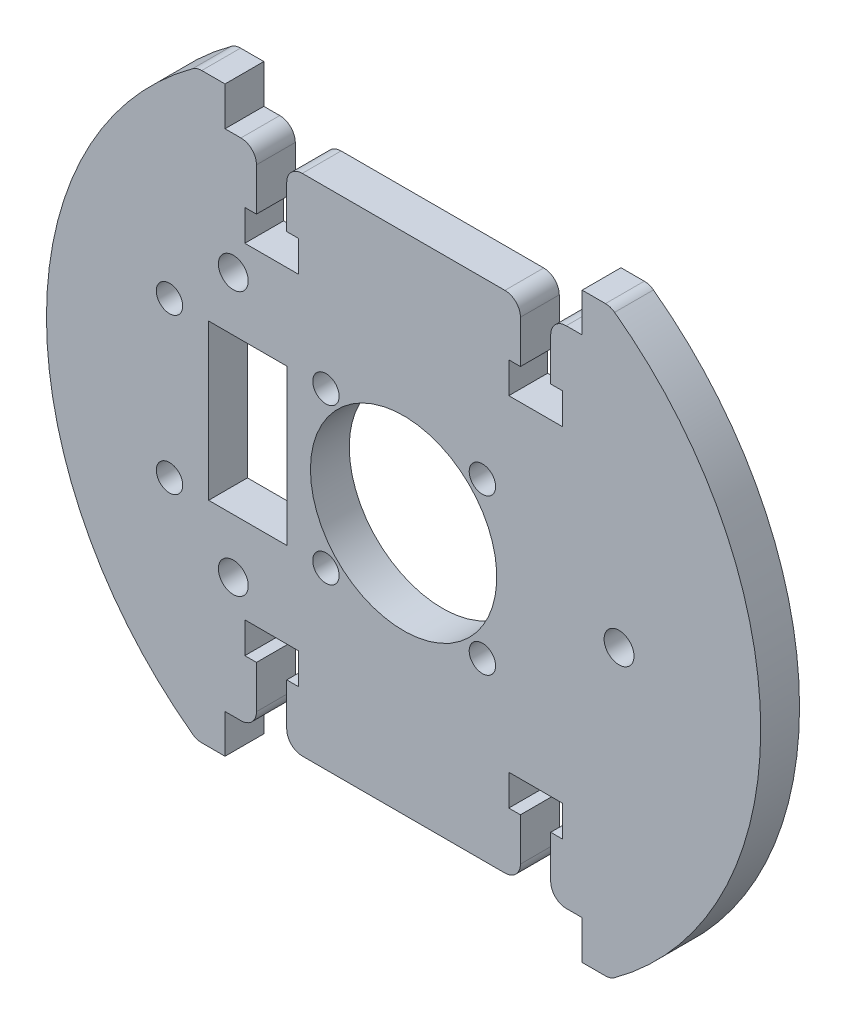
from build123d import *

# Parameters (mm, degrees)
ESQUISSE1_R         = 1.925
BOSS_EXTRU_1_DEPTH  = 5
SKETCH_1_W          = 8.010899758
SKETCH_1_H          = 5.2
SKETCH_1_W_2        = 7.665468451
EXTRUDE_1_DEPTH     = 5
SKETCH_2_W          = 8.485253828
SKETCH_2_H          = 20
EXTRUDE_2_DEPTH     = 5
SKETCH_3_R          = 1.6
CUT_EXTRUDE_1_DEPTH = 5
EXTRUDE_3_DEPTH     = 5
SKETCH_6_R          = 12
SKETCH_6_W          = 10.075
SKETCH_6_H          = 20
CUT_EXTRUDE_2_DEPTH = 5
SKETCH_7_R          = 1.7
SKETCH_7_R_2        = 11
CUT_EXTRUDE_3_DEPTH = 5


with BuildPart() as part:
    # Esquisse1 → Boss.-Extru.1 (new body)
    with BuildSketch(Plane.XY):
        with BuildLine():
            Line((13.05, 32.5), (-13.05, 32.5))
            ThreePointArc((-13.05, 32.5), (-14.464213562, 31.914213562), (-15.05, 30.5))
            Line((-15.05, 30.5), (-15.05, 25))
            Line((-15.05, 25), (-13.55, 25))
            Line((-13.55, 25), (-13.55, 21))
            Line((-13.55, 21), (-20.45, 21))
            Line((-20.45, 21), (-20.45, 25))
            Line((-20.45, 25), (-18.95, 25))
            Line((-18.95, 25), (-18.95, 30.5))
            ThreePointArc((-18.95, 30.5), (-19.535786438, 31.914213562), (-20.95, 32.5))
            Line((-20.95, 32.5), (-23, 32.5))
            Line((-23, 32.5), (-23, 37.5))
            Line((-23, 37.5), (-25.999999067, 37.497633905))
            ThreePointArc((-25.999999067, 37.497633905), (-26.620839292, 37.398317642), (-27.180168114, 37.111163374))
            ThreePointArc((-27.180168114, 37.111163374), (-45.999999844, 0), (-27.180168114, -37.111163374))
            ThreePointArc((-27.180168114, -37.111163374), (-26.620839292, -37.398317642), (-25.999999067, -37.497633905))
            Line((-25.999999067, -37.497633905), (-23, -37.5))
            Line((-23, -37.5), (-23, -32.5))
            Line((-23, -32.5), (-20.95, -32.5))
            ThreePointArc((-20.95, -32.5), (-19.535786438, -31.914213562), (-18.95, -30.5))
            Line((-18.95, -30.5), (-18.95, -25))
            Line((-18.95, -25), (-20.45, -25))
            Line((-20.45, -25), (-20.45, -21))
            Line((-20.45, -21), (-13.55, -21))
            Line((-13.55, -21), (-13.55, -25))
            Line((-13.55, -25), (-15.05, -25))
            Line((-15.05, -25), (-15.05, -30.5))
            ThreePointArc((-15.05, -30.5), (-14.464213562, -31.914213562), (-13.05, -32.5))
            Line((-13.05, -32.5), (13.05, -32.5))
            ThreePointArc((13.05, -32.5), (14.464213562, -31.914213562), (15.05, -30.5))
            Line((15.05, -30.5), (15.05, -25))
            Line((15.05, -25), (13.55, -25))
            Line((13.55, -25), (13.55, -21))
            Line((13.55, -21), (20.45, -21))
            Line((20.45, -21), (20.45, -25))
            Line((20.45, -25), (18.95, -25))
            Line((18.95, -25), (18.95, -30.5))
            ThreePointArc((18.95, -30.5), (19.535786438, -31.914213562), (20.95, -32.5))
            Line((20.95, -32.5), (23, -32.5))
            Line((23, -32.5), (23, -37.5))
            Line((23, -37.5), (25.999999067, -37.497633905))
            ThreePointArc((25.999999067, -37.497633905), (26.620839292, -37.398317642), (27.180168114, -37.111163374))
            ThreePointArc((27.180168114, -37.111163374), (45.999999844, 0), (27.180168114, 37.111163374))
            ThreePointArc((27.180168114, 37.111163374), (26.620839292, 37.398317642), (25.999999067, 37.497633905))
            Line((25.999999067, 37.497633905), (23, 37.5))
            Line((23, 37.5), (23, 32.5))
            Line((23, 32.5), (20.95, 32.5))
            ThreePointArc((20.95, 32.5), (19.535786438, 31.914213562), (18.95, 30.5))
            Line((18.95, 30.5), (18.95, 25))
            Line((18.95, 25), (20.45, 25))
            Line((20.45, 25), (20.45, 21))
            Line((20.45, 21), (13.55, 21))
            Line((13.55, 21), (13.55, 25))
            Line((13.55, 25), (15.05, 25))
            Line((15.05, 25), (15.05, 30.5))
            ThreePointArc((15.05, 30.5), (14.464213562, 31.914213562), (13.05, 32.5))
        make_face()
        with Locations((27.75, 0)):
            Circle(ESQUISSE1_R, mode=Mode.SUBTRACT)
        with Locations((-21.933137835, -17)):
            Circle(ESQUISSE1_R, mode=Mode.SUBTRACT)
        with Locations((-21.933137835, 17)):
            Circle(ESQUISSE1_R, mode=Mode.SUBTRACT)
        with Locations((14.500000149, -5)):
            Circle(ESQUISSE1_R, mode=Mode.SUBTRACT)
        with Locations((14.500000149, 5)):
            Circle(ESQUISSE1_R, mode=Mode.SUBTRACT)
        with Locations((-34.499999851, -5)):
            Circle(ESQUISSE1_R, mode=Mode.SUBTRACT)
        with Locations((-34.499999851, 5)):
            Circle(ESQUISSE1_R, mode=Mode.SUBTRACT)
        with BuildLine():
            Line((10.150000149, -10), (10.150000149, -2.6))
            ThreePointArc((10.150000149, -2.6), (10.735786586, -1.185786438), (12.150000149, -0.6))
            Line((12.150000149, -0.6), (16.500000149, -0.6))
            ThreePointArc((16.500000149, -0.6), (17.100000149, 0), (16.500000149, 0.6))
            Line((16.500000149, 0.6), (12.150000149, 0.6))
            ThreePointArc((12.150000149, 0.6), (10.735786586, 1.185786438), (10.150000149, 2.6))
            Line((10.150000149, 2.6), (10.150000149, 10))
            Line((10.150000149, 10), (-30.149999851, 10))
            Line((-30.149999851, 10), (-30.149999851, 2.6))
            ThreePointArc((-30.149999851, 2.6), (-30.735786289, 1.185786438), (-32.149999851, 0.6))
            Line((-32.149999851, 0.6), (-36.499999851, 0.6))
            ThreePointArc((-36.499999851, 0.6), (-37.099999851, 0), (-36.499999851, -0.6))
            Line((-36.499999851, -0.6), (-32.149999851, -0.6))
            ThreePointArc((-32.149999851, -0.6), (-30.735786289, -1.185786438), (-30.149999851, -2.6))
            Line((-30.149999851, -2.6), (-30.149999851, -10))
            Line((-30.149999851, -10), (10.150000149, -10))
        make_face(mode=Mode.SUBTRACT)
    extrude(amount=BOSS_EXTRU_1_DEPTH)

    # 草图1 → 凸台-拉伸1 (add)
    with BuildSketch(Plane(origin=(0, 0, 0), x_dir=(-1, 0, 0), z_dir=(0, 0, -1))):
        with Locations((34.15544973, 0)):
            Rectangle(SKETCH_1_W, SKETCH_1_H)
        with Locations((-13.982734375, 0)):
            Rectangle(SKETCH_1_W_2, SKETCH_1_H)
    extrude(amount=-EXTRUDE_1_DEPTH)

    # 草图2 → 凸台-拉伸2 (add)
    with BuildSketch(Plane(origin=(0, 0, 0), x_dir=(-1, 0, 0), z_dir=(0, 0, -1))):
        Polygon((-10.150000149, 10), (-18.078472642, 10), (-18.078472642, -9.561252325), (-10.150000149, -10), align=None)
        with Locations((34.392626765, 0)):
            Rectangle(SKETCH_2_W, SKETCH_2_H)
    extrude(amount=-EXTRUDE_2_DEPTH)

    # 草图3 → 切除-拉伸1 (cut)
    with BuildSketch(Plane(origin=(0, 0, 0), x_dir=(-1, 0, 0), z_dir=(0, 0, -1))):
        with Locations((30.149999851, 10)):
            Circle(SKETCH_3_R)
        with Locations((30.149999851, -10)):
            Circle(SKETCH_3_R)
        with Locations((-10.150000149, 10)):
            Circle(SKETCH_3_R)
        with Locations((-10.150000149, -10)):
            Circle(SKETCH_3_R)
        with Locations((9.999999851, -10)):
            Circle(SKETCH_3_R)
        with Locations((9.999999851, 10)):
            Circle(SKETCH_3_R)
    extrude(amount=-CUT_EXTRUDE_1_DEPTH, mode=Mode.SUBTRACT)

    # 草图5 → 凸台-拉伸3 (add)
    with BuildSketch(Plane(origin=(0, 0, 0), x_dir=(-1, 0, 0), z_dir=(0, 0, -1))):
        with BuildLine():
            Line((30.149999851, -8.4), (30.149999851, 8.4))
            ThreePointArc((30.149999851, 8.4), (29.018629001, 8.86862915), (28.549999851, 10))
            Line((28.549999851, 10), (11.599999851, 10))
            ThreePointArc((11.599999851, 10), (9.999999851, 8.4), (8.399999851, 10))
            Line((8.399999851, 10), (-8.550000149, 10))
            ThreePointArc((-8.550000149, 10), (-9.018629299, 8.86862915), (-10.150000149, 8.4))
            Line((-10.150000149, 8.4), (-10.150000149, -8.4))
            ThreePointArc((-10.150000149, -8.4), (-9.018629299, -8.86862915), (-8.550000149, -10))
            Line((-8.550000149, -10), (8.399999851, -10))
            ThreePointArc((8.399999851, -10), (9.999999851, -8.4), (11.599999851, -10))
            Line((11.599999851, -10), (28.549999851, -10))
            ThreePointArc((28.549999851, -10), (29.018629001, -8.86862915), (30.149999851, -8.4))
        make_face()
    extrude(amount=-EXTRUDE_3_DEPTH)

    # 草图6 → 切除-拉伸2 (cut)
    with BuildSketch(Plane(origin=(0, 0, 0), x_dir=(-1, 0, 0), z_dir=(0, 0, -1))):
        Circle(SKETCH_6_R)
        with Locations((20.074999851, 0)):
            Rectangle(SKETCH_6_W, SKETCH_6_H)
    extrude(amount=-CUT_EXTRUDE_2_DEPTH, mode=Mode.SUBTRACT)

    # 草图7 → 切除-拉伸3 (cut)
    with BuildSketch(Plane(origin=(0, 0, 0), x_dir=(-1, 0, 0), z_dir=(0, 0, -1))):
        with Locations((-10.150000149, 10)):
            Circle(SKETCH_7_R)
        with Locations((9.999999851, 10)):
            Circle(SKETCH_7_R)
        with Locations((-10.150000149, -10)):
            Circle(SKETCH_7_R)
        with Locations((9.999999851, -10)):
            Circle(SKETCH_7_R)
        with Locations((30.149999851, -10)):
            Circle(SKETCH_7_R)
        with Locations((30.149999851, 10)):
            Circle(SKETCH_7_R)
        Circle(SKETCH_7_R_2)
    extrude(amount=-CUT_EXTRUDE_3_DEPTH, mode=Mode.SUBTRACT)


solid = part.part
